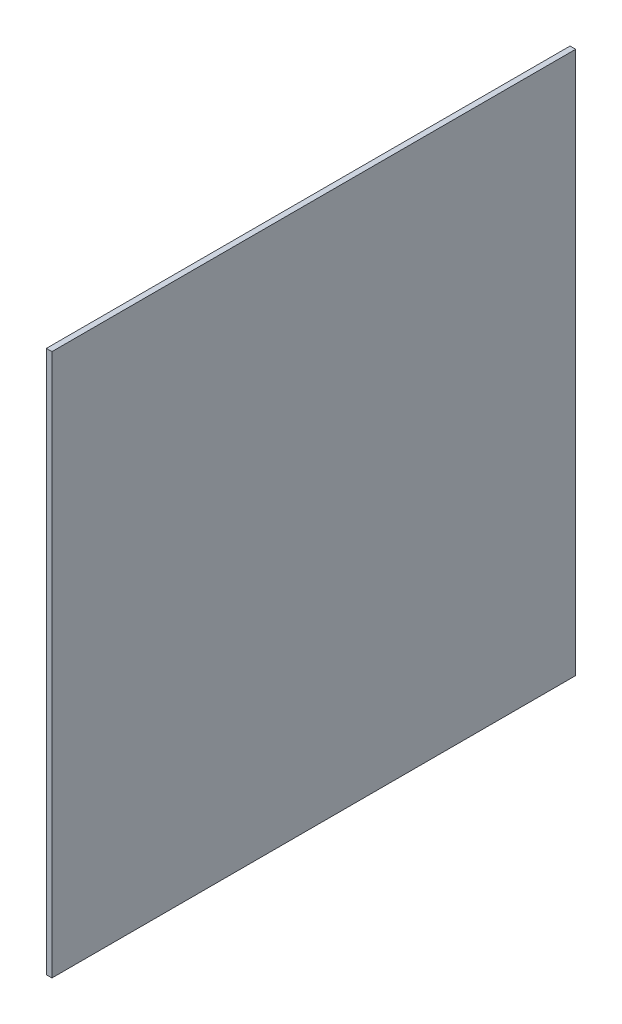
from build123d import *

# Parameters (mm, degrees)
SKETCH_1_W      = 280
SKETCH_1_H      = 290
EXTRUDE_1_DEPTH = 3


with BuildPart() as part:
    # 草图1 → 凸台-拉伸1 (new body)
    with BuildSketch(Plane(origin=(0, 0, 0), x_dir=(0, 0, -1), z_dir=(1, 0, 0))):
        with Locations((93.244868054, -107.037537301)):
            Rectangle(SKETCH_1_W, SKETCH_1_H)
    extrude(amount=EXTRUDE_1_DEPTH)


solid = part.part
